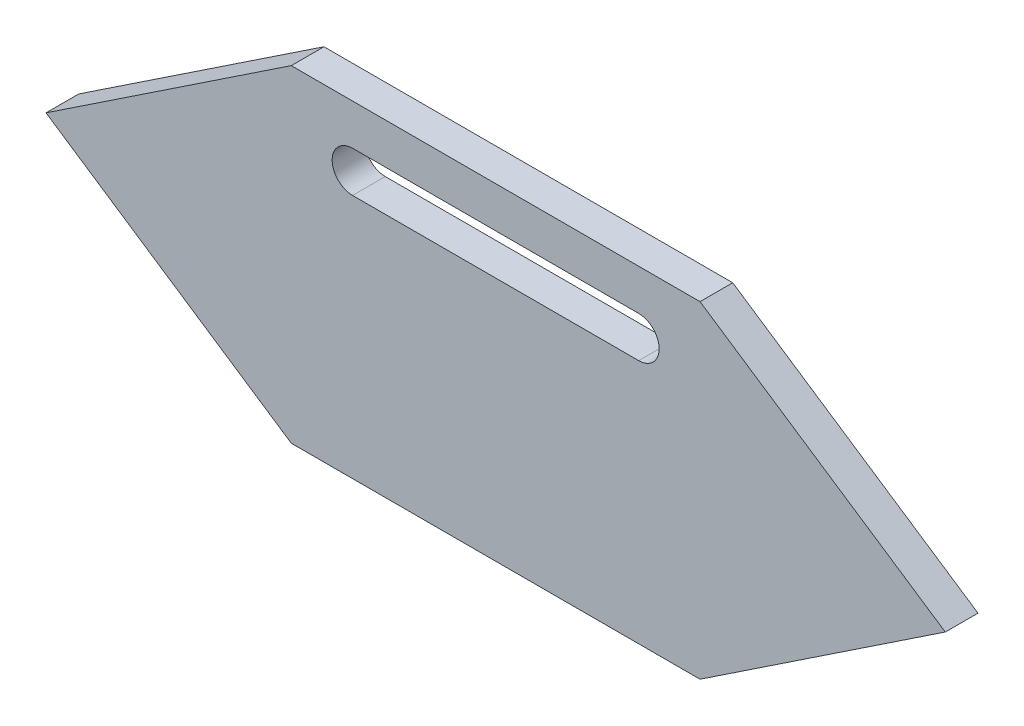
from build123d import *

# Parameters (mm, degrees)
BOSS_EXTRUDE1_DEPTH = 5.08


with BuildPart() as part:
    # Sketch1 → Boss-Extrude1 (new, symmetric)
    with BuildSketch(Plane.XY):
        Polygon((-63.5, 50.8), (63.5, 50.8), (139.7, 0), (63.5, -50.8), (-63.5, -50.8), (-139.7, 0), align=None)
        with BuildLine():
            Line((-44.45, 38.1), (44.45, 38.1))
            ThreePointArc((44.45, 38.1), (50.8, 31.75), (44.45, 25.4))
            Line((44.45, 25.4), (-44.45, 25.4))
            ThreePointArc((-44.45, 25.4), (-50.8, 31.75), (-44.45, 38.1))
        make_face(mode=Mode.SUBTRACT)
    extrude(amount=BOSS_EXTRUDE1_DEPTH, both=True)


solid = part.part
